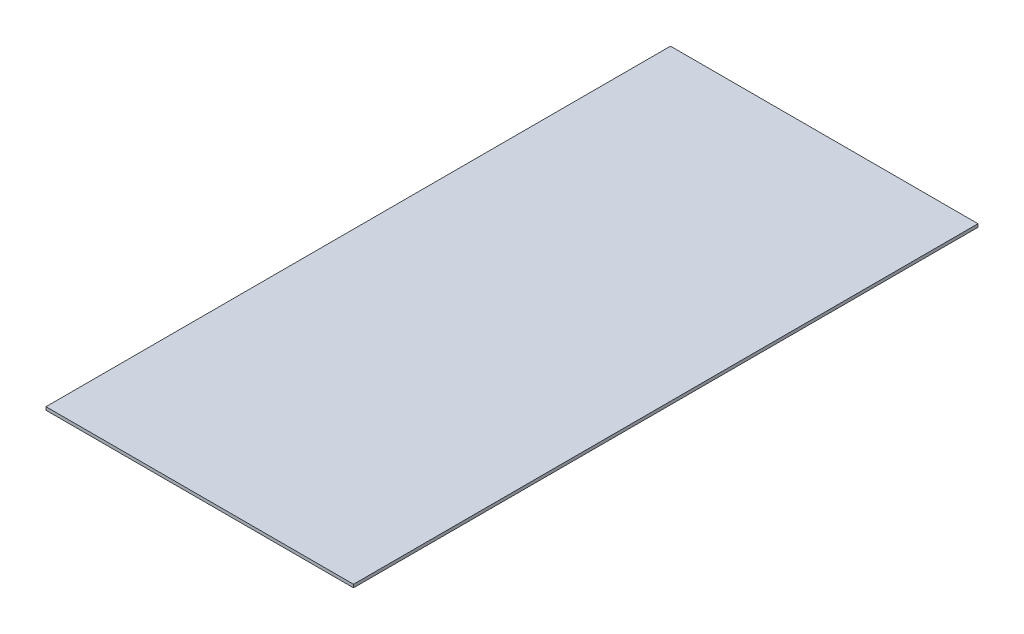
from build123d import *

# Parameters (mm, degrees)
CROQUIS1_W     = 980
CROQUIS1_H     = 1990
EXTRUIR1_DEPTH = 10


with BuildPart() as part:
    # Croquis1 → Extruir1 (new body)
    with BuildSketch(Plane(origin=(0, 0, 0), x_dir=(1, 0, 0), z_dir=(0, 1, 0))):
        Rectangle(CROQUIS1_W, CROQUIS1_H)
    extrude(amount=EXTRUIR1_DEPTH)


solid = part.part
